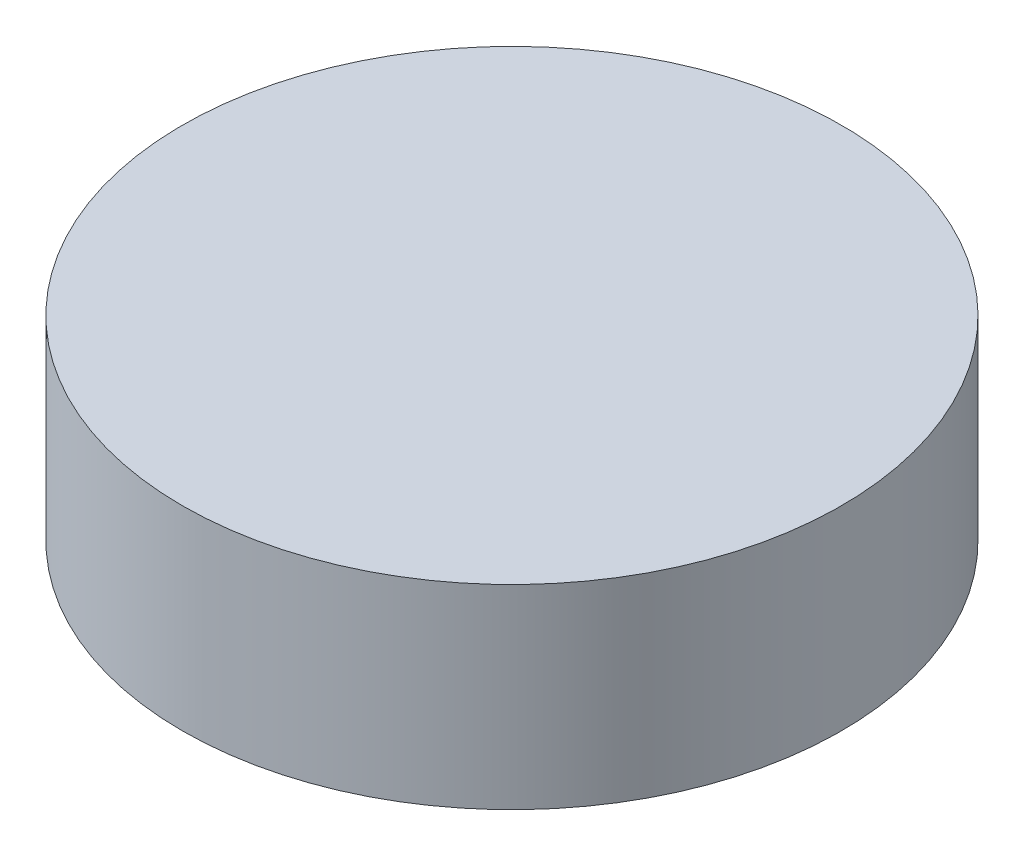
from build123d import *

# Parameters (mm, degrees)
SKETCH1_R           = 2400
BOSS_EXTRUDE1_DEPTH = 1420


with BuildPart() as part:
    # Sketch1 → Boss-Extrude1 (new body)
    with BuildSketch(Plane(origin=(0, 0, 0), x_dir=(1, 0, 0), z_dir=(0, 1, 0))):
        with Locations(Location((0, 0, 0), (0, 0, 270))):
            Circle(SKETCH1_R)
    extrude(amount=BOSS_EXTRUDE1_DEPTH)


solid = part.part
